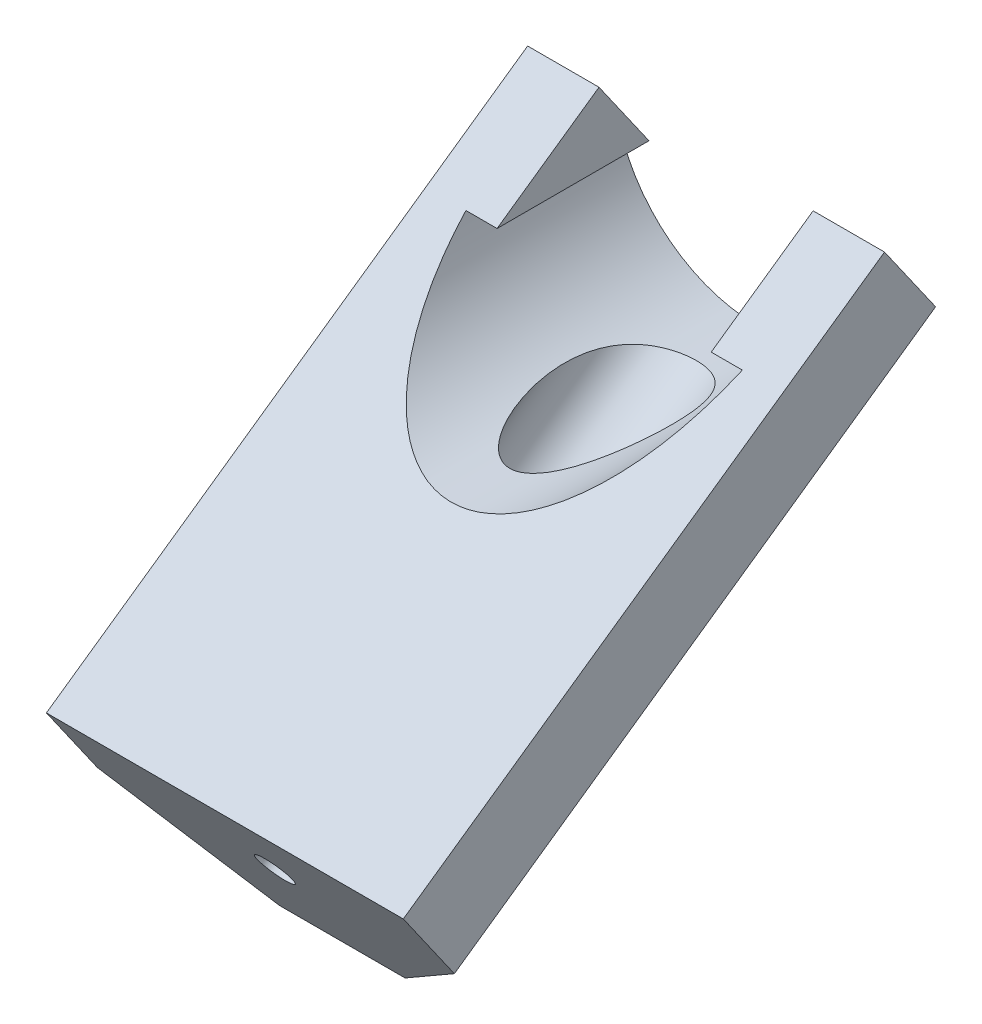
from build123d import *

# Parameters (mm, degrees)
BOSS_EXTRUDE1_DEPTH = 50
CUT_EXTRUDE1_DEPTH  = 76
CUT_EXTRUDE2_DEPTH  = 59.548154505
BOSS_EXTRUDE2_REACH = 77
CUT_EXTRUDE3_DEPTH  = 100.601194791
SKETCH8_R           = 2.5
CUT_EXTRUDE4_DEPTH  = 100.601194791
SKETCH9_R           = 7.5
CUT_EXTRUDE5_DEPTH  = 40


with BuildPart() as part:
    # Sketch1 → Boss-Extrude1 (new body)
    with BuildSketch(Plane.XY):
        with BuildLine():
            Line((-15, 0), (-15, 5))
            Line((-15, 5), (-25, 5))
            Line((-25, 5), (-25, -25))
            Line((-25, -25), (25, -25))
            Line((25, -25), (25, 5))
            Line((25, 5), (15, 5))
            Line((15, 5), (15, -5))
            Line((15, -5), (19.364916731, -5))
            ThreePointArc((19.364916731, -5), (0, -20), (-19.364916731, -5))
            Line((-19.364916731, -5), (-15, -5))
            Line((-15, -5), (-15, 0))
        make_face()
    extrude(amount=BOSS_EXTRUDE1_DEPTH)

    # Sketch2 → Cut-Extrude1 (cut, through all)
    with BuildSketch(Plane(origin=(25, 0, 0), x_dir=(0, 0, -1), z_dir=(1, 0, 0))):
        Polygon((0, 5), (-7.155559798, 5), (0, -5.219198462), align=None)
        Polygon((-50, 5), (-50, -25), (-7.155559798, 5), align=None)
    extrude(amount=-CUT_EXTRUDE1_DEPTH, mode=Mode.SUBTRACT)

    # Sketch4 → Cut-Extrude2 (cut, through all)
    with BuildSketch(Plane(origin=(0, -1.717063728, 2.452221141), x_dir=(-1, 0, 0), z_dir=(0, 0.573576436351043, -0.8191520442889939))):
        Polygon((25, -4.27531709), (0, -29.27531709), (25, -29.27531709), align=None)
        Polygon((0, -29.27531709), (-25, -4.27531709), (-25, -29.27531709), align=None)
    extrude(amount=-CUT_EXTRUDE2_DEPTH, mode=Mode.SUBTRACT)

    # Boss-Extrude2: up to this face of the body (flat: up to its plane)
    boss_extrude2_end = Plane(part.part.faces().sort_by_distance((-25, -12.379979849, 21.845856759))[0])
    # Sketch6 → Boss-Extrude2 (add, up to the picked face)
    with BuildSketch(Plane(origin=(25, 0, 0), x_dir=(0, 0, -1), z_dir=(1, 0, 0)), mode=Mode.PRIVATE) as boss_extrude2_sk1:
        Polygon((-50, -25), (-74.574561329, -42.207293091), (-58.125064912, -65.69960861), (0, -25), align=None)
    boss_extrude2_tool1 = split(extrude(boss_extrude2_sk1.sketch, amount=-BOSS_EXTRUDE2_REACH, mode=Mode.PRIVATE), bisect_by=boss_extrude2_end, keep=Keep.BOTH, mode=Mode.PRIVATE)
    add(boss_extrude2_tool1.solids().sort_by(Axis((25, -40.270944, 43.428409), (-1, 0, 0)))[0])

    # Sketch7 → Cut-Extrude3 (cut, through all)
    with BuildSketch(Plane(origin=(0, -1.717063728, 2.452221141), x_dir=(-1, 0, 0), z_dir=(0, 0.573576436351043, -0.8191520442889939))):
        Polygon((25, -4.27531709), (25, -20.478801107), (8.796515983, -20.478801107), align=None)
        Polygon((-25, -4.27531709), (-8.796515983, -20.478801107), (-25, -20.478801107), align=None)
    extrude(amount=-CUT_EXTRUDE3_DEPTH, mode=Mode.SUBTRACT)

    # Sketch8 → Cut-Extrude4 (cut, through all)
    with BuildSketch(Plane(origin=(0, -1.717063728, 2.452221141), x_dir=(-1, 0, 0), z_dir=(0, 0.573576436351043, -0.8191520442889939))):
        with Locations(Location((0, -4.007725177, 0), (0, 0, 90))):
            Circle(SKETCH8_R)
    extrude(amount=-CUT_EXTRUDE4_DEPTH, mode=Mode.SUBTRACT)

    # Sketch9 → Cut-Extrude5 (cut)
    with BuildSketch(Plane(origin=(0, -1.717063728, 2.452221141), x_dir=(-1, 0, 0), z_dir=(0, 0.573576436351043, -0.8191520442889939))):
        with Locations(Location((0, -4.007725177, 0), (0, 0, 90))):
            Circle(SKETCH9_R)
    extrude(amount=-CUT_EXTRUDE5_DEPTH, mode=Mode.SUBTRACT)


solid = part.part
